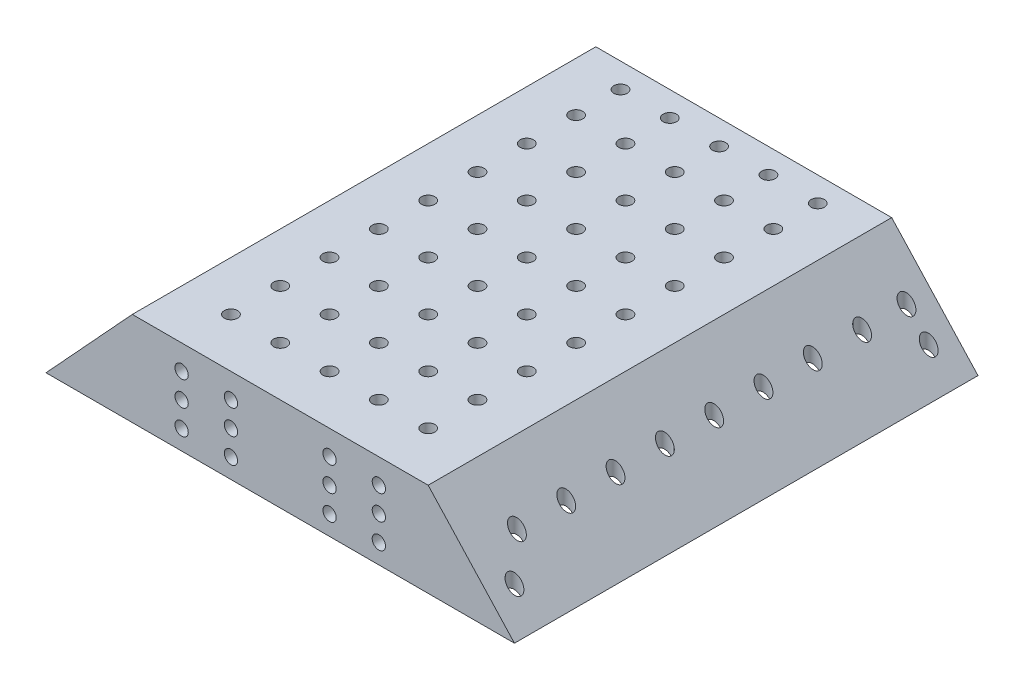
from build123d import *

# Parameters (mm, degrees)
CROQUIS2_W                     = 60
CROQUIS2_H                     = 19
SALIENTE_EXTRUIR1_DEPTH        = 94
CORTAR_EXTRUIR1_DEPTH          = 91
TALADRO_DE_MARGEN_PARA_M2_51_D = 2.7
TALADRO_DE_MARGEN_PARA_M2_52_D = 2.7


with BuildPart() as part:
    # Croquis2 → Saliente-Extruir1 (new body)
    with BuildSketch(Plane.XY):
        with Locations((0, 9.5)):
            Rectangle(CROQUIS2_W, CROQUIS2_H)
        Polygon((-30, 0), (-30, 19), (-47.5, 0), align=None)
        Polygon((47.5, 0), (30, 0), (30, 19), align=None)
    extrude(amount=SALIENTE_EXTRUIR1_DEPTH)

    # Croquis3 → Cortar-Extruir1 (cut)
    with BuildSketch(Plane(origin=(0, 0, 0), x_dir=(-1, 0, 0), z_dir=(0, 0, -1))):
        Polygon((-30, 16), (-44.736842105, 0), (44.736842105, 0), (30, 16), align=None)
    extrude(amount=-CORTAR_EXTRUIR1_DEPTH, mode=Mode.SUBTRACT)

    # Taladro de margen para M2.51 (through all)
    with Locations(Plane(origin=(0, 19, 0), x_dir=(1, 0, 0), z_dir=(0, 1, 0))):
        with Locations((-42.5, -5), (42.5, -5), (42.5, -89), (-42.5, -89), (-38, -5), (-38, -14), (-38, -24), (-38, -34), (-38, -44), (-38, -54), (-38, -64), (-38, -74), (-38, -84), (-20, -5), (-20, -14), (-20, -24), (-20, -34), (-20, -44), (-20, -54), (-20, -64), (-20, -74), (-20, -84), (0, -5), (0, -14), (0, -24), (0, -34), (0, -44), (0, -54), (0, -64), (0, -74), (0, -84), (20, -5), (20, -14), (20, -24), (20, -34), (20, -44), (20, -54), (20, -64), (20, -74), (20, -84), (38, -5), (38, -14), (38, -24), (38, -34), (38, -44), (38, -54), (38, -64), (38, -74), (38, -84), (-10, -5), (-10, -14), (-10, -24), (-10, -34), (-10, -44), (-10, -54), (-10, -64), (-10, -74), (-10, -84), (10, -5), (10, -14), (10, -24), (10, -34), (10, -44), (10, -54), (10, -64), (10, -74), (10, -84)):
            Hole(TALADRO_DE_MARGEN_PARA_M2_51_D / 2)

    # Taladro de margen para M2.52 (through all)
    with Locations(Plane(origin=(-20, 14, 94), x_dir=(1, 0, 0), z_dir=(0, 0, 1))):
        with Locations((0, 0), (0, -5), (0, -10.037142857), (10, -10.037142857), (10, -5), (10, 0), (30, -10.037142857), (30, -5), (30, 0), (40, 0), (40, -5), (40, -10.037142857)):
            Hole(TALADRO_DE_MARGEN_PARA_M2_52_D / 2)


solid = part.part
